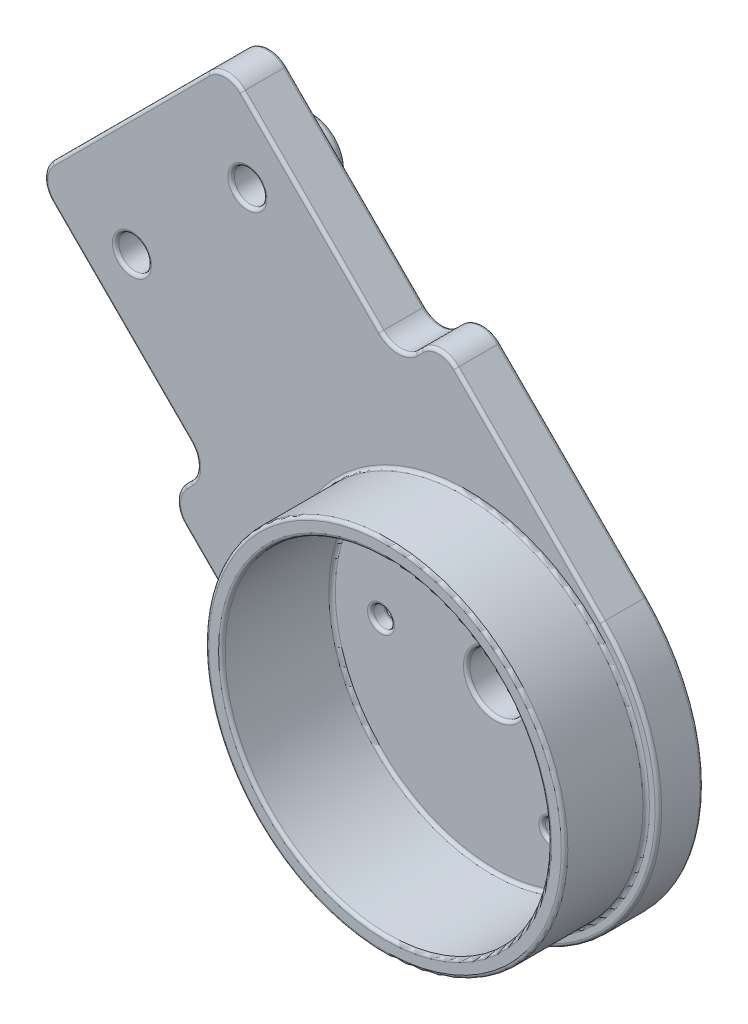
from build123d import *

# Parameters (mm, degrees)
SKETCH6_R           = 10
SKETCH6_R_2         = 1
BOSS_EXTRUDE1_DEPTH = 2.75
BOSS_EXTRUDE2_START = -1
SKETCH7_R           = 10
BOSS_EXTRUDE2_DEPTH = 1
BOSS_EXTRUDE3_START = 5
SKETCH8_R           = 11
SKETCH8_R_2         = 10
BOSS_EXTRUDE3_DEPTH = 5
SKETCH9_R           = 2
SKETCH9_R_2         = 1
BOSS_EXTRUDE4_DEPTH = 1.25
FILLET1_R           = 1.5
SKETCH10_R          = 1.75
CUT_EXTRUDE1_DEPTH  = 1.25
BOSS_EXTRUDE5_START = 4.25
SKETCH11_R          = 3.45
SKETCH11_R_2        = 1.75
BOSS_EXTRUDE5_DEPTH = 4.25
SKETCH12_R          = 0.625
CUT_EXTRUDE2_DEPTH  = 4.25
FILLET3_R           = 0.2


with BuildPart() as part:
    # Sketch6 → Boss-Extrude1 (new body)
    with BuildSketch(Plane.XY):
        with BuildLine():
            Line((73.522435529, 14.810302582), (85.189697418, 26.477564471))
            Line((85.189697418, 26.477564471), (95.796299136, 15.870962753))
            Line((95.796299136, 15.870962753), (98.27117287, 18.345836488))
            Line((98.27117287, 18.345836488), (108.308504679, 8.308504679))
            ThreePointArc((108.308504679, 8.308504679), (108.308504679, -8.308504679), (91.691495321, -8.308504679))
            Line((91.691495321, -8.308504679), (81.654163512, 1.72882713))
            Line((81.654163512, 1.72882713), (84.129037247, 4.203700864))
            Line((84.129037247, 4.203700864), (73.522435529, 14.810302582))
        make_face()
        with Locations((100, 0)):
            Circle(SKETCH6_R, mode=Mode.SUBTRACT)
        with Locations((79.493903346, 13.435028843)):
            Circle(SKETCH6_R_2, mode=Mode.SUBTRACT)
        with Locations((86.564971157, 20.506096654)):
            Circle(SKETCH6_R_2, mode=Mode.SUBTRACT)
    extrude(amount=-BOSS_EXTRUDE1_DEPTH)

    # Sketch7 → Boss-Extrude2 (add)
    with BuildSketch(Plane(origin=(0, 0, -2.75), x_dir=(-1, 0, 0), z_dir=(0, 0, -1)).offset(BOSS_EXTRUDE2_START)):
        with Locations(Location((-100, 0, 0), (0, 0, 180))):
            Circle(SKETCH7_R)
    extrude(amount=BOSS_EXTRUDE2_DEPTH)

    # Sketch8 → Boss-Extrude3 (add)
    with BuildSketch(Plane.XY.offset(BOSS_EXTRUDE3_START)):
        with Locations((100, 0)):
            Circle(SKETCH8_R)
        with Locations((100, 0)):
            Circle(SKETCH8_R_2, mode=Mode.SUBTRACT)
    extrude(amount=-BOSS_EXTRUDE3_DEPTH)

    # Sketch9 → Boss-Extrude4 (add)
    # profile 1 of 2: a face of its own
    with BuildSketch(Plane(origin=(0, 0, -2.75), x_dir=(-1, 0, 0), z_dir=(0, 0, -1))):
        with Locations(Location((-86.564971157, 20.506096654, 0), (0, 0, 180))):
            Circle(SKETCH9_R)
        with Locations(Location((-86.564971157, 20.506096654, 0), (0, 0, 180))):
            Circle(SKETCH9_R_2, mode=Mode.SUBTRACT)
    # profile 2 of 2: a face of its own
    with BuildSketch(Plane(origin=(0, 0, -2.75), x_dir=(-1, 0, 0), z_dir=(0, 0, -1))):
        with Locations(Location((-79.493903346, 13.435028843, 0), (0, 0, 180))):
            Circle(SKETCH9_R)
        with Locations(Location((-79.493903346, 13.435028843, 0), (0, 0, 180))):
            Circle(SKETCH9_R_2, mode=Mode.SUBTRACT)
    extrude(amount=BOSS_EXTRUDE4_DEPTH)

    # Fillet1
    fillet1_edges = [part.edges().sort_by_distance(p)[0] for p in [
        (73.522435529, 14.810302582, -1.375),
        (85.189697418, 26.477564471, -1.375),
        (95.796299136, 15.870962753, -1.375),
        (98.27117287, 18.345836488, -1.375),
        (81.654163512, 1.72882713, -1.375),
        (84.129037247, 4.203700864, -1.375),
    ]]
    fillet(fillet1_edges, radius=FILLET1_R)

    # Sketch10 → Cut-Extrude1 (cut)
    with BuildSketch(Plane(origin=(0, 0, -2.75), x_dir=(-1, 0, 0), z_dir=(0, 0, -1))):
        with Locations((-100, 0)):
            Circle(SKETCH10_R)
    extrude(amount=-CUT_EXTRUDE1_DEPTH, mode=Mode.SUBTRACT)

    # Sketch11 → Boss-Extrude5 (add)
    with BuildSketch(Plane(origin=(0, 0, -2.75), x_dir=(-1, 0, 0), z_dir=(0, 0, -1)).offset(BOSS_EXTRUDE5_START)):
        with Locations(Location((-100, 0, 0), (0, 0, 180))):
            Circle(SKETCH11_R)
        with Locations((-100, 0)):
            Circle(SKETCH11_R_2, mode=Mode.SUBTRACT)
    extrude(amount=-BOSS_EXTRUDE5_DEPTH)

    # Sketch12 → Cut-Extrude2 (cut)
    with BuildSketch(Plane(origin=(0, 0, -2.75), x_dir=(-1, 0, 0), z_dir=(0, 0, -1))):
        with Locations((-93, 0)):
            Circle(SKETCH12_R)
        with Locations((-103.5, -6.062177826)):
            Circle(SKETCH12_R)
        with Locations((-103.5, 6.062177826)):
            Circle(SKETCH12_R)
    extrude(amount=-CUT_EXTRUDE2_DEPTH, mode=Mode.SUBTRACT)

    # Fillet3
    fillet3_edges = [part.edges().sort_by_distance(p)[0] for p in [
        (108.308504679, -8.308504679, 0),
        (101.75, 0, -1.75),
        (96.55, 0, -2.75),
        (96.55, 0, -7),
        (101.75, 0, -7),
        (93.625, 0, -1.75),
        (93.625, 0, -2.75),
        (104.125, -6.062177826, -1.75),
        (104.125, -6.062177826, -2.75),
        (104.125, 6.062177826, -1.75),
        (104.125, 6.062177826, -2.75),
        (108.308504679, -8.308504679, -2.75),
        (103.820168861, 12.796840497, -2.75),
        (78.493903346, 13.435028843, 0),
        (85.564971157, 20.506096654, 0),
        (90, 0, -1.75),
        (89, 0, 5),
        (89, 0, 0),
        (90, 0, 5),
        (84.564971157, 20.506096654, -2.75),
        (84.564971157, 20.506096654, -4),
        (85.564971157, 20.506096654, -4),
        (77.493903346, 13.435028843, -2.75),
        (77.493903346, 13.435028843, -4),
        (78.493903346, 13.435028843, -4),
        (78.825736388, 9.507001723, 0),
        (78.825736388, 9.507001723, -2.75),
        (82.891600379, 2.966263997, 0),
        (82.891600379, 2.966263997, -2.75),
        (87.203159503, -3.820168861, 0),
        (97.033736003, 17.108399621, 0),
        (90.492998277, 21.174263612, 0),
        (79.356066474, 20.643933526, 0),
        (74.143755872, 14.810302582, 0),
        (85.189697418, 25.856244128, 0),
        (98.27117287, 17.724516144, 0),
        (82.275483856, 1.72882713, 0),
        (87.203159503, -3.820168861, -2.75),
        (79.356066474, 20.643933526, -2.75),
        (90.492998277, 21.174263612, -2.75),
        (97.033736003, 17.108399621, -2.75),
        (74.143755872, 14.810302582, -2.75),
        (85.189697418, 25.856244128, -2.75),
        (98.27117287, 17.724516144, -2.75),
        (82.275483856, 1.72882713, -2.75),
        (83.507716903, 4.203700864, 0),
        (83.507716903, 4.203700864, -2.75),
        (95.796299136, 16.492283097, 0),
        (95.796299136, 16.492283097, -2.75),
        (103.820168861, 12.796840497, 0),
    ]]
    fillet(fillet3_edges, radius=FILLET3_R)


solid = part.part
